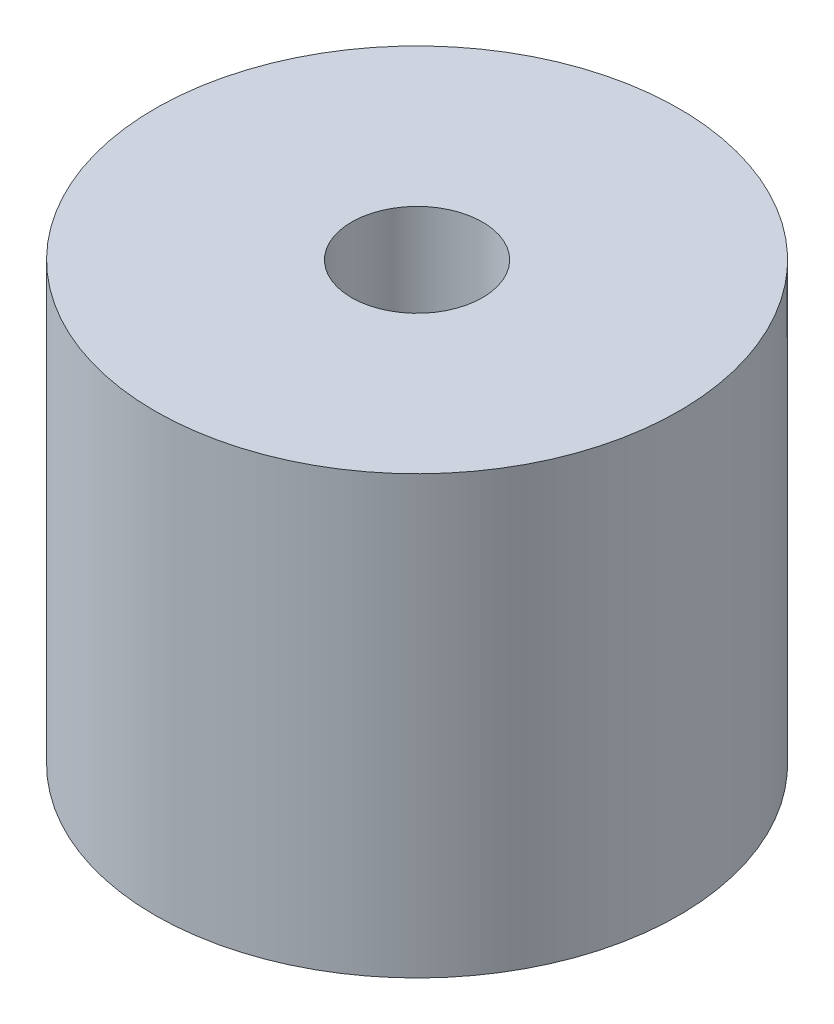
from build123d import *

# Parameters (mm, degrees)
SKETCH1_R           = 12
BOSS_EXTRUDE1_DEPTH = 20
CUT_EXTRUDE1_DEPTH  = 13
SKETCH3_R           = 3
CUT_EXTRUDE2_DEPTH  = 13


with BuildPart() as part:
    # Sketch1 → Boss-Extrude1 (new body)
    with BuildSketch(Plane(origin=(0, 0, 0), x_dir=(1, 0, 0), z_dir=(0, 1, 0))):
        with Locations(Location((0, 0, 0), (0, 0, 270))):
            Circle(SKETCH1_R)
    extrude(amount=BOSS_EXTRUDE1_DEPTH)

    # Sketch2 → Cut-Extrude1 (cut)
    with BuildSketch(Plane.XZ):
        with BuildLine():
            Line((3.05, 2.739981752), (3.05, -2.739981752))
            ThreePointArc((3.05, -2.739981752), (-4.1, 0), (3.05, 2.739981752))
        make_face()
    extrude(amount=-CUT_EXTRUDE1_DEPTH, mode=Mode.SUBTRACT)

    # Sketch3 → Cut-Extrude2 (cut)
    with BuildSketch(Plane(origin=(0, 20, 0), x_dir=(1, 0, 0), z_dir=(0, 1, 0))):
        with Locations(Location((0, 0, 0), (0, 0, 270))):
            Circle(SKETCH3_R)
    extrude(amount=-CUT_EXTRUDE2_DEPTH, mode=Mode.SUBTRACT)


solid = part.part
